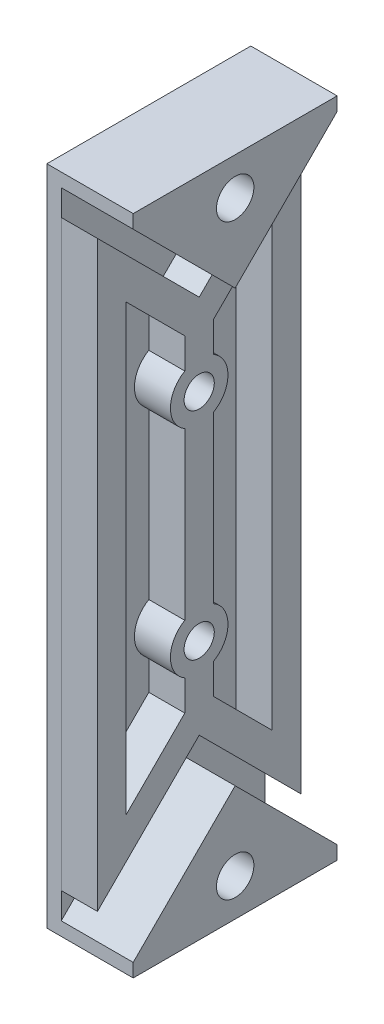
from build123d import *

# Parameters (mm, degrees)
BOSS_EXTRUDE1_DEPTH   = 5
CUT_EXTRUDE1_DEPTH    = 86.941840799
BOSS_EXTRUDE6_DEPTH   = 5
BOSS_EXTRUDE6_2_DEPTH = 5
SKETCH4_W             = 28.34
SKETCH4_H             = 92
BOSS_EXTRUDE7_DEPTH   = 2
SKETCH5_R             = 2.6
CUT_EXTRUDE2_DEPTH    = 92.284319703
BOSS_EXTRUDE8_REACH   = 93.284
SKETCH6_R             = 4
SKETCH7_R             = 2.1
CUT_EXTRUDE4_DEPTH    = 92.284319703
BOSS_EXTRUDE9_START   = 5
SKETCH8_R             = 2.6
BOSS_EXTRUDE9_DEPTH   = 5


with BuildPart() as part:
    # Sketch1 → Boss-Extrude1 (new body)
    with BuildSketch(Plane(origin=(0, 0, 0), x_dir=(0, 0, -1), z_dir=(1, 0, 0))):
        Polygon((0, 0), (0, -81), (14.142135624, -66.857864376), (28.284271247, -81), (28.284271247, 0), (14.142135624, -14.142135624), align=None)
    extrude(amount=BOSS_EXTRUDE1_DEPTH)

    # Sketch2 → Cut-Extrude1 (cut, through all)
    with BuildSketch(Plane(origin=(5, 0, 0), x_dir=(0, 0, -1), z_dir=(1, 0, 0))):
        Polygon((4, -71.343145751), (12.142135624, -63.201010127), (12.142135624, -17.798989873), (4, -9.656854249), align=None)
        Polygon((16.142135624, -17.798989873), (16.142135624, -63.201010127), (24.284271247, -71.343145751), (24.284271247, -9.656854249), align=None)
    extrude(amount=-CUT_EXTRUDE1_DEPTH, mode=Mode.SUBTRACT)



with BuildPart() as body_2:
    # Sketch3 → Boss-Extrude6 (new body)
    with BuildSketch(Plane(origin=(5, 0, 0), x_dir=(0, 0, -1), z_dir=(1, 0, 0))):
        Polygon((-0.027864376, 3.619966825), (1.796051224, 1.796051224), (14.142135624, -10.550033175), (26.488220023, 1.796051224), (28.312135624, 3.619966825), (28.312135624, 5.5), (-0.027864376, 5.5), align=None)
    extrude(amount=-BOSS_EXTRUDE6_DEPTH)


with BuildPart() as body_3:
    # Sketch3 → Boss-Extrude6 2 (new body)
    with BuildSketch(Plane(origin=(5, 0, 0), x_dir=(0, 0, -1), z_dir=(1, 0, 0))):
        Polygon((14.142135624, -70.449966825), (1.796051224, -82.796051224), (-0.027864376, -84.619966825), (-0.027864376, -86.5), (28.312135624, -86.5), (28.312135624, -84.619966825), (26.488220023, -82.796051224), align=None)
    extrude(amount=-BOSS_EXTRUDE6_2_DEPTH)


with BuildPart() as part_1:
    add(part.part)

    add(body_2.part)  # Boss-Extrude7 merges body 2

    add(body_3.part)  # Boss-Extrude7 merges body 3
    # Sketch4 → Boss-Extrude7 (add)
    with BuildSketch(Plane.ZY):
        with Locations((-14.142135624, -40.5)):
            Rectangle(SKETCH4_W, SKETCH4_H)
    extrude(amount=BOSS_EXTRUDE7_DEPTH)

    # Sketch5 → Cut-Extrude2 (cut, through all)
    with BuildSketch(Plane(origin=(5, 0, 0), x_dir=(0, 0, -1), z_dir=(1, 0, 0))):
        with Locations((14.142135624, 0.3)):
            Circle(SKETCH5_R)
        with Locations(Location((14.142135624, -81.3, 0), (0, 0, 180))):
            Circle(SKETCH5_R)
    extrude(amount=-CUT_EXTRUDE2_DEPTH, mode=Mode.SUBTRACT)

    # Sketch6 → Boss-Extrude8 (add, up to next)
    with BuildSketch(Plane(origin=(5, 0, 0), x_dir=(0, 0, -1), z_dir=(1, 0, 0)), mode=Mode.PRIVATE) as boss_extrude8_sk1:
        with Locations((14.142135624, -55.5)):
            Circle(SKETCH6_R)
    boss_extrude8_tool1 = extrude(boss_extrude8_sk1.sketch, amount=-BOSS_EXTRUDE8_REACH, mode=Mode.PRIVATE) - part_1.part
    # Sketch6 → Boss-Extrude8 (add, up to next)
    with BuildSketch(Plane(origin=(5, 0, 0), x_dir=(0, 0, -1), z_dir=(1, 0, 0)), mode=Mode.PRIVATE) as boss_extrude8_sk2:
        with Locations((14.142135624, -25.5)):
            Circle(SKETCH6_R)
    boss_extrude8_tool2 = extrude(boss_extrude8_sk2.sketch, amount=-BOSS_EXTRUDE8_REACH, mode=Mode.PRIVATE) - part_1.part
    add(boss_extrude8_tool1.solids().sort_by_distance((5, -55.5, -14.142136))[0])
    add(boss_extrude8_tool1.solids().sort_by_distance((5, -55.5, -14.142136))[1])
    add(boss_extrude8_tool2.solids().sort_by_distance((5, -25.5, -14.142136))[0])
    add(boss_extrude8_tool2.solids().sort_by_distance((5, -25.5, -14.142136))[1])

    # Sketch7 → Cut-Extrude4 (cut, through all)
    with BuildSketch(Plane(origin=(5, 0, 0), x_dir=(0, 0, -1), z_dir=(1, 0, 0))):
        with Locations((14.142135624, -25.5)):
            Circle(SKETCH7_R)
        with Locations((14.142135624, -55.5)):
            Circle(SKETCH7_R)
    extrude(amount=-CUT_EXTRUDE4_DEPTH, mode=Mode.SUBTRACT)

    # Sketch8 → Boss-Extrude9 (add)
    # profile 1 of 2: a face of its own
    with BuildSketch(Plane(origin=(5, 0, 0), x_dir=(0, 0, -1), z_dir=(1, 0, 0)).offset(BOSS_EXTRUDE9_START)):
        Polygon((28.312135624, 5.5), (28.312135624, 3.619966825), (14.142135624, -10.550033175), (-0.027864376, 3.619966825), (-0.027864376, 5.5), align=None)
        with Locations((14.142135624, 0.3)):
            Circle(SKETCH8_R, mode=Mode.SUBTRACT)
    # profile 2 of 2: a face of its own
    with BuildSketch(Plane(origin=(5, 0, 0), x_dir=(0, 0, -1), z_dir=(1, 0, 0)).offset(BOSS_EXTRUDE9_START)):
        Polygon((28.312135624, -86.5), (28.312135624, -84.619966825), (14.142135624, -70.449966825), (-0.027864376, -84.619966825), (-0.027864376, -86.5), align=None)
        with Locations(Location((14.142135624, -81.3, 0), (0, 0, 180))):
            Circle(SKETCH8_R, mode=Mode.SUBTRACT)
    extrude(amount=-BOSS_EXTRUDE9_DEPTH)


solid = part_1.part
